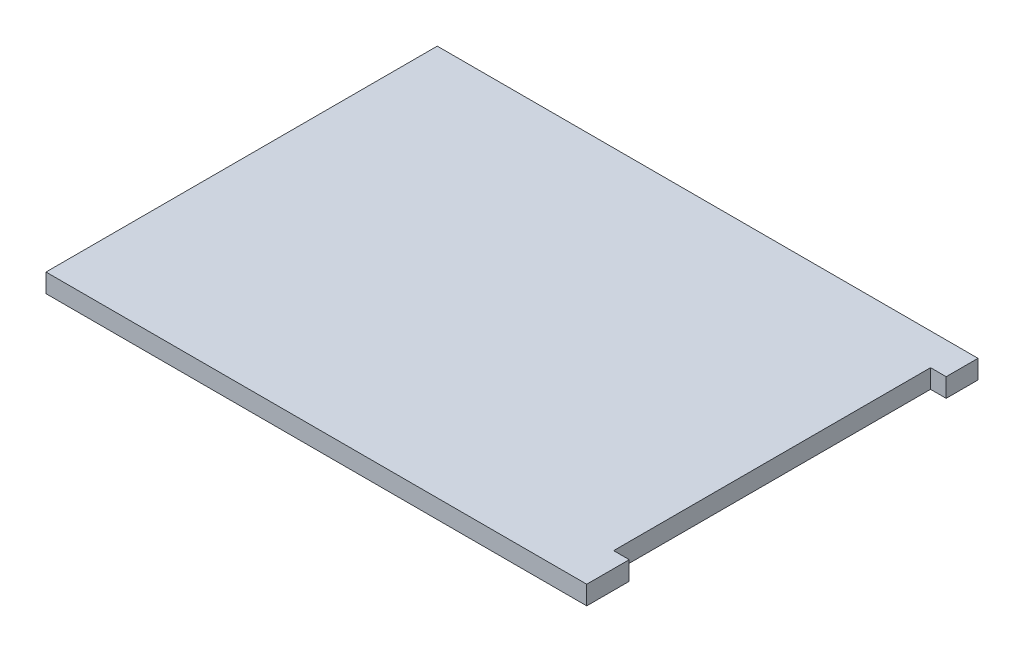
from build123d import *

# Parameters (mm, degrees)
SKETCH_1_W          = 69.1
SKETCH_1_H          = 50
EXTRUDE_1_DEPTH     = 2.4
SKETCH_2_W          = 3.99338924
SKETCH_2_H          = 40.5
CUT_EXTRUDE_1_DEPTH = 2.4


with BuildPart() as part:
    # 草图1 → 凸台-拉伸1 (new body)
    with BuildSketch(Plane(origin=(0, 0, 0), x_dir=(1, 0, 0), z_dir=(0, 1, 0))):
        with Locations((3.15, 0)):
            Rectangle(SKETCH_1_W, SKETCH_1_H)
    extrude(amount=EXTRUDE_1_DEPTH)

    # 草图2 → 切除-拉伸1 (cut)
    with BuildSketch(Plane.XZ):
        with Locations((37.7, -0.682318686)):
            Rectangle(SKETCH_2_W, SKETCH_2_H)
    extrude(amount=-CUT_EXTRUDE_1_DEPTH, mode=Mode.SUBTRACT)


solid = part.part
